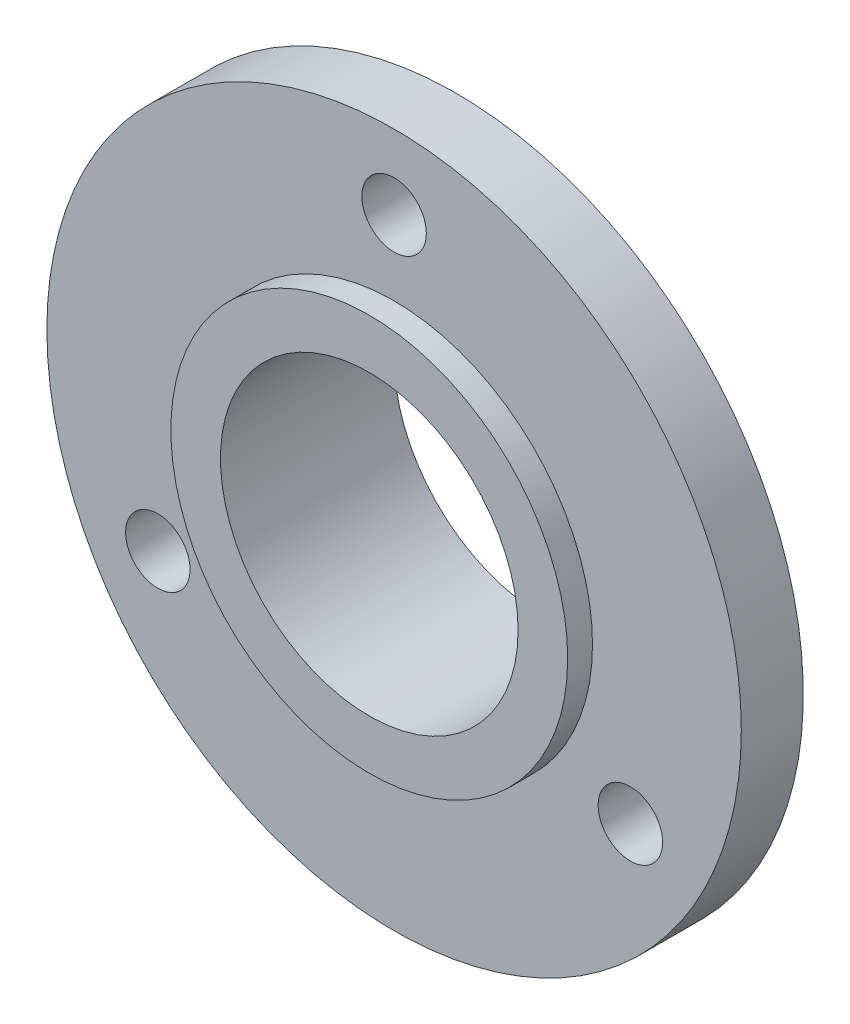
from build123d import *

# Parameters (mm, degrees)
ESQUISSE1_R                  = 14
ESQUISSE1_R_2                = 6
BOSS_EXTRU_1_DEPTH           = 7
ENL_V_START                  = -1
ESQUISSE2_R                  = 14
ESQUISSE2_R_2                = 8
ENL_V_MAT_EXTRU_1_DEPTH      = 1
ESQUISSE3_OUTSIDE_W          = 38.042
ESQUISSE3_OUTSIDE_H          = 38.042
ESQUISSE3_OUTSIDE_R          = 8
ENL_V_MAT_EXTRU_2_DEPTH      = 3.5
ESQUISSE4_R                  = 1.3
ENL_V_MAT_EXTRU_3_DEPTH      = 8
R_P_TITION_CIRCULAIRE1_COUNT = 3


with BuildPart() as part:
    # Esquisse1 → Boss.-Extru.1 (new body)
    with BuildSketch(Plane.XY):
        Circle(ESQUISSE1_R)
        Circle(ESQUISSE1_R_2, mode=Mode.SUBTRACT)
    extrude(amount=BOSS_EXTRU_1_DEPTH)

    # Esquisse2 → Enlèv. mat.-Extru.1 (cut)
    with BuildSketch(Plane.XY.offset(7).offset(ENL_V_START)):
        Circle(ESQUISSE2_R)
        Circle(ESQUISSE2_R_2, mode=Mode.SUBTRACT)
    extrude(amount=ENL_V_MAT_EXTRU_1_DEPTH, mode=Mode.SUBTRACT)

    # Esquisse3 outside → Enlèv. mat.-Extru.2 (cut)
    with BuildSketch(Plane(origin=(0, 0, 0), x_dir=(-1, 0, 0), z_dir=(0, 0, -1))):
        Rectangle(ESQUISSE3_OUTSIDE_W, ESQUISSE3_OUTSIDE_H)
        with Locations(Location((0, 0, 0), (0, 0, 180))):
            Circle(ESQUISSE3_OUTSIDE_R, mode=Mode.SUBTRACT)
    extrude(amount=-ENL_V_MAT_EXTRU_2_DEPTH, mode=Mode.SUBTRACT)

    # Esquisse4 → Enlèv. mat.-Extru.3 (cut)
    with BuildSketch(Plane.XY):
        with Locations(Location((0, 11, 0), (0, 0, 180))):
            Circle(ESQUISSE4_R)
    enl_v_mat_extru_3 = extrude(amount=ENL_V_MAT_EXTRU_3_DEPTH, mode=Mode.SUBTRACT)

    # Répétition circulaire1: Enlèv. mat.-Extru.3 ×3 about axis
    r_p_tition_circulaire1_axis = Axis((0, 0, 0), (0, 0, 1))
    for i in range(1, R_P_TITION_CIRCULAIRE1_COUNT):
        add(enl_v_mat_extru_3.rotate(r_p_tition_circulaire1_axis, i * 360 / R_P_TITION_CIRCULAIRE1_COUNT), mode=Mode.SUBTRACT)


solid = part.part
